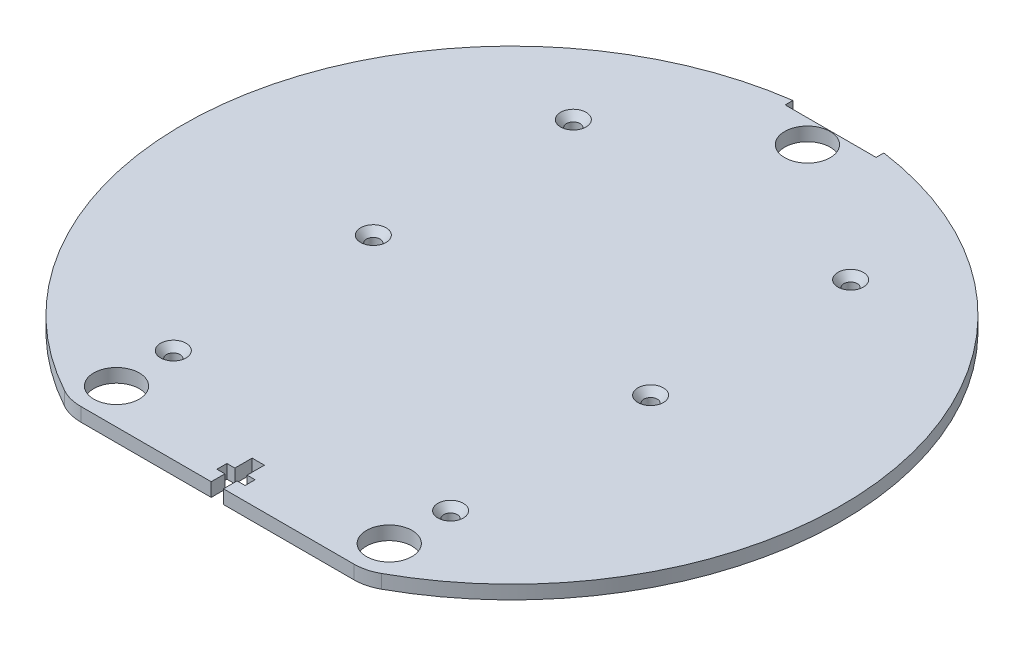
from build123d import *
from OCP.BRepFilletAPI import BRepFilletAPI_MakeChamfer

# Parameters (mm, degrees)
BOSS_EXTRUDE1_DEPTH = 3
SKETCH2_R           = 1.5
CUT_EXTRUDE1_DEPTH  = 103.574363269
CHAMFER1_SIZE       = 1.5
CHAMFER1_SIZE2      = 1.303930107
CUT_EXTRUDE2_DEPTH  = 103.574363269
SKETCH4_W           = 20
SKETCH4_H           = 1.7
CUT_EXTRUDE3_DEPTH  = 103.574363269
SKETCH5_R           = 5
CUT_EXTRUDE4_DEPTH  = 103.085748271


with BuildPart() as part:
    # Sketch1 → Boss-Extrude1 (new body)
    with BuildSketch(Plane(origin=(0, 0, 0), x_dir=(1, 0, 0), z_dir=(0, 1, 0))):
        with BuildLine():
            Line((30.029977361, -64.812867647), (-30.029977361, -64.812867647))
            ThreePointArc((-30.029977361, -64.812867647), (-32.509837414, -64.500503794), (-34.834773739, -63.582926471))
            ThreePointArc((-34.834773739, -63.582926471), (0, 72.5), (34.834773739, -63.582926471))
            ThreePointArc((34.834773739, -63.582926471), (32.509837414, -64.500503794), (30.029977361, -64.812867647))
        make_face()
    extrude(amount=BOSS_EXTRUDE1_DEPTH)

    # Sketch2 → Cut-Extrude1 (cut, through all)
    with BuildSketch(Plane(origin=(0, 3, 0), x_dir=(1, 0, 0), z_dir=(0, 1, 0))):
        with Locations(Location((-30.5, 44, 0), (0, 0, 270))):
            Circle(SKETCH2_R)
        with Locations(Location((30.5, 44, 0), (0, 0, 270))):
            Circle(SKETCH2_R)
        with Locations(Location((30.5, 0, 0), (0, 0, 270))):
            Circle(SKETCH2_R)
        with Locations(Location((30.5, -44, 0), (0, 0, 270))):
            Circle(SKETCH2_R)
        with Locations(Location((-30.5, -44, 0), (0, 0, 270))):
            Circle(SKETCH2_R)
        with Locations(Location((-30.5, 0, 0), (0, 0, 270))):
            Circle(SKETCH2_R)
    extrude(amount=-CUT_EXTRUDE1_DEPTH, mode=Mode.SUBTRACT)

    # Chamfer1: one chamfer whose edges measure the first distance from different faces: ONE call of the kernel's chamfer builder (chamfer() names one face for all edges)
    chamfer1_edges_1 = [part.edges().sort_by_distance(p)[0] for p in [
        (-30.5, 3, -45.5),
    ]]
    chamfer1_side_1 = [part.faces().sort_by_distance(p)[0] for p in [
        (-30.5, 1.5, -45.5),
    ]]
    chamfer1_edges_2 = [part.edges().sort_by_distance(p)[0] for p in [
        (-30.5, 3, -1.5),
    ]]
    chamfer1_side_2 = [part.faces().sort_by_distance(p)[0] for p in [
        (-30.5, 1.5, -1.5),
    ]]
    chamfer1_edges_3 = [part.edges().sort_by_distance(p)[0] for p in [
        (-30.5, 3, 42.5),
    ]]
    chamfer1_side_3 = [part.faces().sort_by_distance(p)[0] for p in [
        (-30.5, 1.5, 42.5),
    ]]
    chamfer1_edges_4 = [part.edges().sort_by_distance(p)[0] for p in [
        (30.5, 3, 42.5),
    ]]
    chamfer1_side_4 = [part.faces().sort_by_distance(p)[0] for p in [
        (30.5, 1.5, 42.5),
    ]]
    chamfer1_edges_5 = [part.edges().sort_by_distance(p)[0] for p in [
        (30.5, 3, -1.5),
    ]]
    chamfer1_side_5 = [part.faces().sort_by_distance(p)[0] for p in [
        (30.5, 1.5, -1.5),
    ]]
    chamfer1_edges_6 = [part.edges().sort_by_distance(p)[0] for p in [
        (30.5, 3, -45.5),
    ]]
    chamfer1_side_6 = [part.faces().sort_by_distance(p)[0] for p in [
        (30.5, 1.5, -45.5),
    ]]
    chamfer1 = BRepFilletAPI_MakeChamfer(part.part.solid().wrapped)
    for e in chamfer1_edges_1:
        chamfer1.Add(CHAMFER1_SIZE, CHAMFER1_SIZE2, e.wrapped, chamfer1_side_1[0].wrapped)  # the first distance lies on this face
    for e in chamfer1_edges_2:
        chamfer1.Add(CHAMFER1_SIZE, CHAMFER1_SIZE2, e.wrapped, chamfer1_side_2[0].wrapped)  # the first distance lies on this face
    for e in chamfer1_edges_3:
        chamfer1.Add(CHAMFER1_SIZE, CHAMFER1_SIZE2, e.wrapped, chamfer1_side_3[0].wrapped)  # the first distance lies on this face
    for e in chamfer1_edges_4:
        chamfer1.Add(CHAMFER1_SIZE, CHAMFER1_SIZE2, e.wrapped, chamfer1_side_4[0].wrapped)  # the first distance lies on this face
    for e in chamfer1_edges_5:
        chamfer1.Add(CHAMFER1_SIZE, CHAMFER1_SIZE2, e.wrapped, chamfer1_side_5[0].wrapped)  # the first distance lies on this face
    for e in chamfer1_edges_6:
        chamfer1.Add(CHAMFER1_SIZE, CHAMFER1_SIZE2, e.wrapped, chamfer1_side_6[0].wrapped)  # the first distance lies on this face
    add(Compound.cast(chamfer1.Shape()), mode=Mode.REPLACE)

    # Sketch3 → Cut-Extrude2 (cut, through all)
    with BuildSketch(Plane(origin=(0, 3, 0), x_dir=(1, 0, 0), z_dir=(0, 1, 0))):
        Polygon((1.35, -61.812867647), (3.1, -61.812867647), (3.1, -59.612867647), (1.35, -59.612867647), (1.35, -55.812867647), (-1.35, -55.812867647), (-1.35, -59.612867647), (-3.1, -59.612867647), (-3.1, -61.812867647), (-1.35, -61.812867647), (-1.35, -64.812867647), (1.35, -64.812867647), align=None)
    extrude(amount=-CUT_EXTRUDE2_DEPTH, mode=Mode.SUBTRACT)

    # Sketch4 → Cut-Extrude3 (cut, through all)
    with BuildSketch(Plane(origin=(0, 3, 0), x_dir=(1, 0, 0), z_dir=(0, 1, 0))):
        with Locations((0, 70.957033082)):
            Rectangle(SKETCH4_W, SKETCH4_H)
    extrude(amount=-CUT_EXTRUDE3_DEPTH, mode=Mode.SUBTRACT)


with BuildPart() as body_2:
    # of the pieces the cut leaves, the one that is kept (cut_extrude3_keep)
    add(part.part.solids().sort_by_distance((-30.029977361, 3, 64.812867647))[0])

    # Sketch5 → Cut-Extrude4 (cut, through all)
    with BuildSketch(Plane(origin=(0, 3, 0), x_dir=(1, 0, 0), z_dir=(0, 1, 0))):
        with Locations(Location((0, 65, 0), (0, 0, 270))):
            Circle(SKETCH5_R)
        with Locations(Location((30, -57, 0), (0, 0, 90))):
            Circle(SKETCH5_R)
        with Locations(Location((-30, -57, 0), (0, 0, 270))):
            Circle(SKETCH5_R)
    extrude(amount=-CUT_EXTRUDE4_DEPTH, mode=Mode.SUBTRACT)


solid = body_2.part
